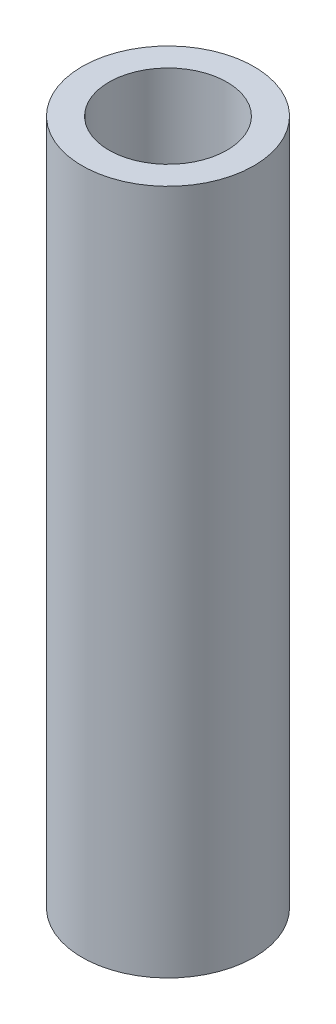
from build123d import *

# Parameters (mm, degrees)
SKETCH1_R           = 8.775
SKETCH1_R_2         = 6.025
EXTRUDE_THIN1_DEPTH = 70


with BuildPart() as part:
    # Sketch1 → Extrude-Thin1 (new body)
    with BuildSketch(Plane(origin=(0, 0, 0), x_dir=(1, 0, 0), z_dir=(0, 1, 0))):
        Circle(SKETCH1_R)
        Circle(SKETCH1_R_2, mode=Mode.SUBTRACT)
    extrude(amount=EXTRUDE_THIN1_DEPTH)


solid = part.part
